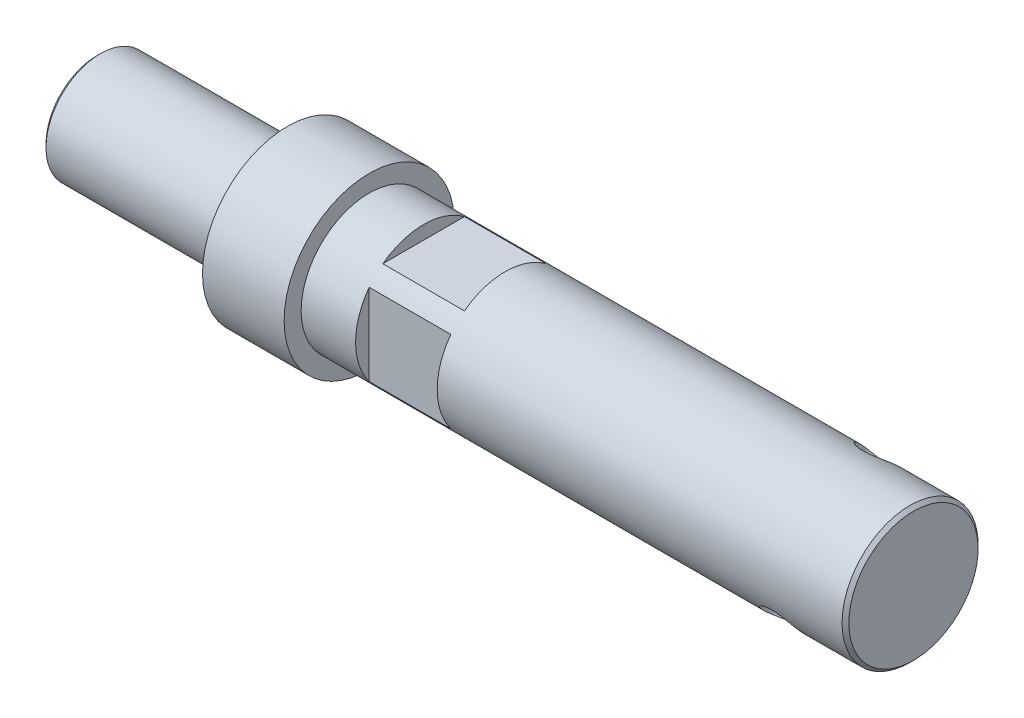
from build123d import *

# Parameters (mm, degrees)
SKETCH_2_OUTSIDE_W       = 102.04
SKETCH_2_OUTSIDE_H       = 102.04
SKETCH_2_OUTSIDE_W_2     = 32
SKETCH_2_OUTSIDE_H_2     = 32
CUT_EXTRUDE_1_DEPTH      = 24
CUT_EXTRUDE_2_DEPTH      = 5
CUT_EXTRUDE_3_DEPTH      = 243.590189414
CUT_EXTRUDE_3_DEPTH_BACK = 243.590189414
SKETCH_4_R               = 6


with BuildPart() as part:
    # Эскиз1 → Повернуть1 (revolve)
    with BuildSketch(Plane.XY, mode=Mode.PRIVATE) as revolve_1_sk:
        Polygon((0, 0), (0, 19), (-1, 20), (-160, 20), (-160, 25), (-184, 25), (-184, 16), (-239, 16), (-240, 15), (-240, 0), align=None)
    revolve(revolve_1_sk.sketch.rotate(Axis((-178.322580645, 0, 0), (1, 0, 0)), 90), axis=Axis((-178.322580645, 0, 0), (1, 0, 0)))

    # Эскиз2 outside → Вырез-Вытянуть1 (cut)
    with BuildSketch(Plane(origin=(-144, 0, 0), x_dir=(0, 0, -1), z_dir=(1, 0, 0))):
        Rectangle(SKETCH_2_OUTSIDE_W, SKETCH_2_OUTSIDE_H)
        Rectangle(SKETCH_2_OUTSIDE_W_2, SKETCH_2_OUTSIDE_H_2, mode=Mode.SUBTRACT)
    extrude(amount=CUT_EXTRUDE_1_DEPTH, mode=Mode.SUBTRACT)

    # Эскиз3 → Вырез-Вытянуть2 (cut)
    with BuildSketch(Plane(origin=(0, -16, 0), x_dir=(-1, 0, 0), z_dir=(0, -1, 0))):
        with BuildLine():
            Line((227, -6), (197, -6))
            ThreePointArc((197, -6), (191, 0), (197, 6))
            Line((197, 6), (227, 6))
            ThreePointArc((227, 6), (233, 0), (227, -6))
        make_face()
    extrude(amount=-CUT_EXTRUDE_2_DEPTH, mode=Mode.SUBTRACT)

    # Эскиз4 → Вырез-Вытянуть3 (cut, two sides: drawn at the far end of the back side and taken through both)
    with BuildSketch(Plane(origin=(0, 0, 0), x_dir=(-1, 0, 0), z_dir=(0, -0.7071067811865488, 0.7071067811865464)).offset(-CUT_EXTRUDE_3_DEPTH_BACK)):
        with Locations(Location((24, 0, 0), (0, 0, 90))):
            Circle(SKETCH_4_R)
    extrude(amount=CUT_EXTRUDE_3_DEPTH + CUT_EXTRUDE_3_DEPTH_BACK, mode=Mode.SUBTRACT)


solid = part.part
